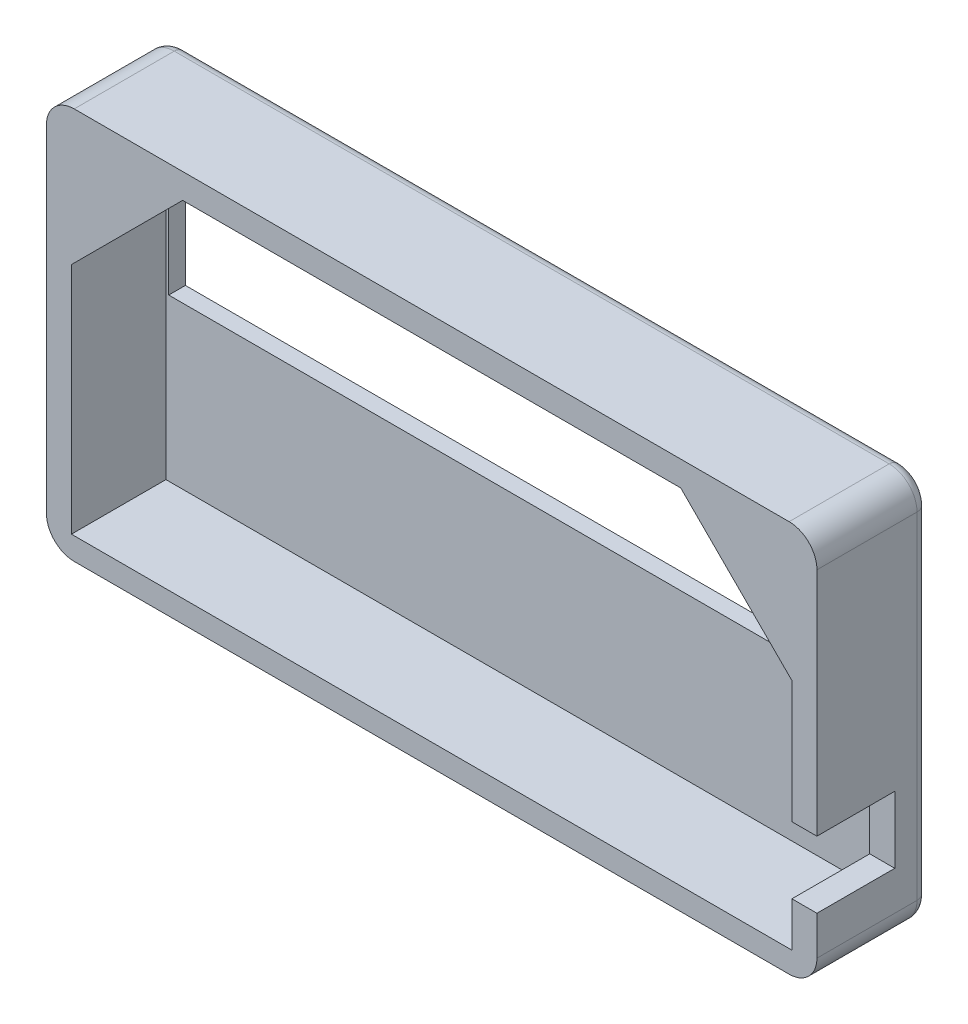
from build123d import *

# Parameters (mm, degrees)
SKETCH1_W           = 138.6
SKETCH1_H           = 70.5
SKETCH1_W_2         = 128.6
SKETCH1_H_2         = 32.5
BOSS_EXTRUDE1_DEPTH = 20
SKETCH2_W           = 129.6
SKETCH2_H           = 62
CUT_EXTRUDE1_DEPTH  = 17
FILLET2_R           = 5
FILLET3_R           = 2
SKETCH3_W           = 4.5
SKETCH3_H           = 12
CUT_EXTRUDE2_DEPTH  = 14
BOSS_EXTRUDE2_DEPTH = 2


with BuildPart() as part:
    # Sketch1 → Boss-Extrude1 (new body)
    with BuildSketch(Plane.XY):
        with Locations((-15.947491639, 11.815217391)):
            Rectangle(SKETCH1_W, SKETCH1_H)
        with Locations((-15.947491639, 25.815217391)):
            Rectangle(SKETCH1_W_2, SKETCH1_H_2, mode=Mode.SUBTRACT)
    extrude(amount=BOSS_EXTRUDE1_DEPTH)

    # Sketch2 → Cut-Extrude1 (cut)
    with BuildSketch(Plane.XY.offset(20)):
        with Locations((-15.947491639, 11.565217391)):
            Rectangle(SKETCH2_W, SKETCH2_H)
    extrude(amount=-CUT_EXTRUDE1_DEPTH, mode=Mode.SUBTRACT)

    # Fillet2
    fillet2_edges = [part.edges().sort_by_distance(p)[0] for p in [
        (-85.247491639, 47.065217391, 10),
        (53.352508361, 47.065217391, 10),
        (53.352508361, -23.434782609, 10),
        (-85.247491639, -23.434782609, 10),
    ]]
    fillet(fillet2_edges, radius=FILLET2_R)

    # Fillet3
    fillet3_edges = [part.edges().sort_by_distance(p)[0] for p in [
        (-15.947491639, 47.065217391, 0),
        (-85.247491639, 11.815217391, 0),
        (53.352508361, 11.815217391, 0),
        (-15.947491639, -23.434782609, 0),
        (51.888042267, -21.970316515, 0),
        (-83.783025545, -21.970316515, 0),
        (-83.783025545, 45.600751297, 0),
        (51.888042267, 45.600751297, 0),
    ]]
    fillet(fillet3_edges, radius=FILLET3_R)

    # Sketch3 → Cut-Extrude2 (cut)
    with BuildSketch(Plane.XY.offset(20)):
        with Locations((51.102508361, -5.434782609)):
            Rectangle(SKETCH3_W, SKETCH3_H)
    extrude(amount=-CUT_EXTRUDE2_DEPTH, mode=Mode.SUBTRACT)

    # Sketch4 → Boss-Extrude2 (add)
    with BuildSketch(Plane.XY.offset(20)):
        Polygon((-60.747491639, 42.565217391), (-80.747491639, 22.565217391), (-80.747491639, 42.565217391), align=None)
        Polygon((48.852508361, 22.565217391), (48.852508361, 42.565217391), (28.852508361, 42.565217391), align=None)
    extrude(amount=-BOSS_EXTRUDE2_DEPTH)


solid = part.part
